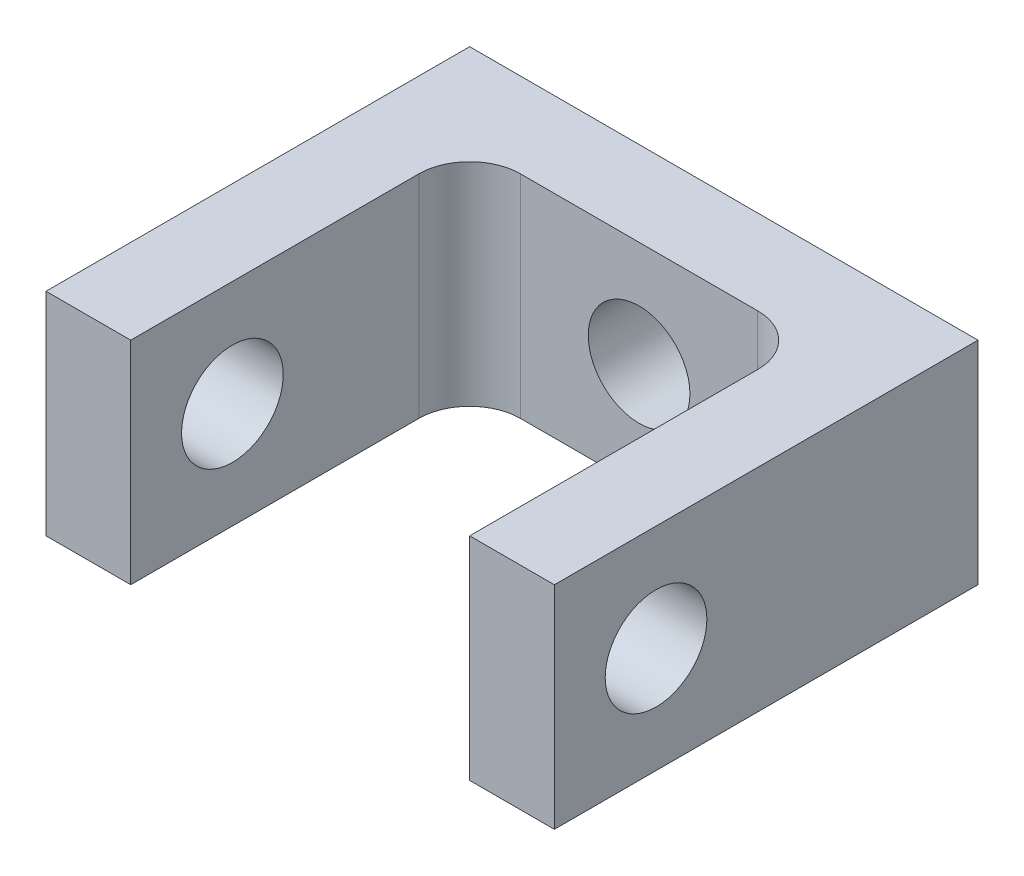
from build123d import *

# Parameters (mm, degrees)
SZKIC1_W                    = 60
SZKIC1_H                    = 25
SZKIC1_R                    = 6
DODANIE_WYCI_GNI_CIE1_DEPTH = 10
SZKIC2_W                    = 10
SZKIC2_H                    = 25
DODANIE_WYCI_GNI_CIE2_DEPTH = 40
ZAOKR_GLENIE1_R             = 6
SZKIC3_R                    = 6
WYTNIJ_WYCI_GNI_CIE1_DEPTH  = 70


with BuildPart() as part:
    # Szkic1 → Dodanie-wyciągnięcie1 (new body)
    with BuildSketch(Plane.XY):
        Rectangle(SZKIC1_W, SZKIC1_H)
        Circle(SZKIC1_R, mode=Mode.SUBTRACT)
    extrude(amount=DODANIE_WYCI_GNI_CIE1_DEPTH)

    # Szkic2 → Dodanie-wyciągnięcie2 (add)
    with BuildSketch(Plane.XY.offset(10)):
        with Locations((-25, 0)):
            Rectangle(SZKIC2_W, SZKIC2_H)
        with Locations((25, 0)):
            Rectangle(SZKIC2_W, SZKIC2_H)
    extrude(amount=DODANIE_WYCI_GNI_CIE2_DEPTH)

    # Zaokrąglenie1
    zaokr_glenie1_edges = [part.edges().sort_by_distance(p)[0] for p in [
        (-20, 0, 10),
        (20, 0, 10),
    ]]
    fillet(zaokr_glenie1_edges, radius=ZAOKR_GLENIE1_R)

    # Szkic3 → Wytnij-wyciągnięcie1 (cut)
    with BuildSketch(Plane.ZY.offset(30)):
        with Locations(Location((38, 0, 0), (0, 0, 180))):
            Circle(SZKIC3_R)
    extrude(amount=-WYTNIJ_WYCI_GNI_CIE1_DEPTH, mode=Mode.SUBTRACT)


solid = part.part
